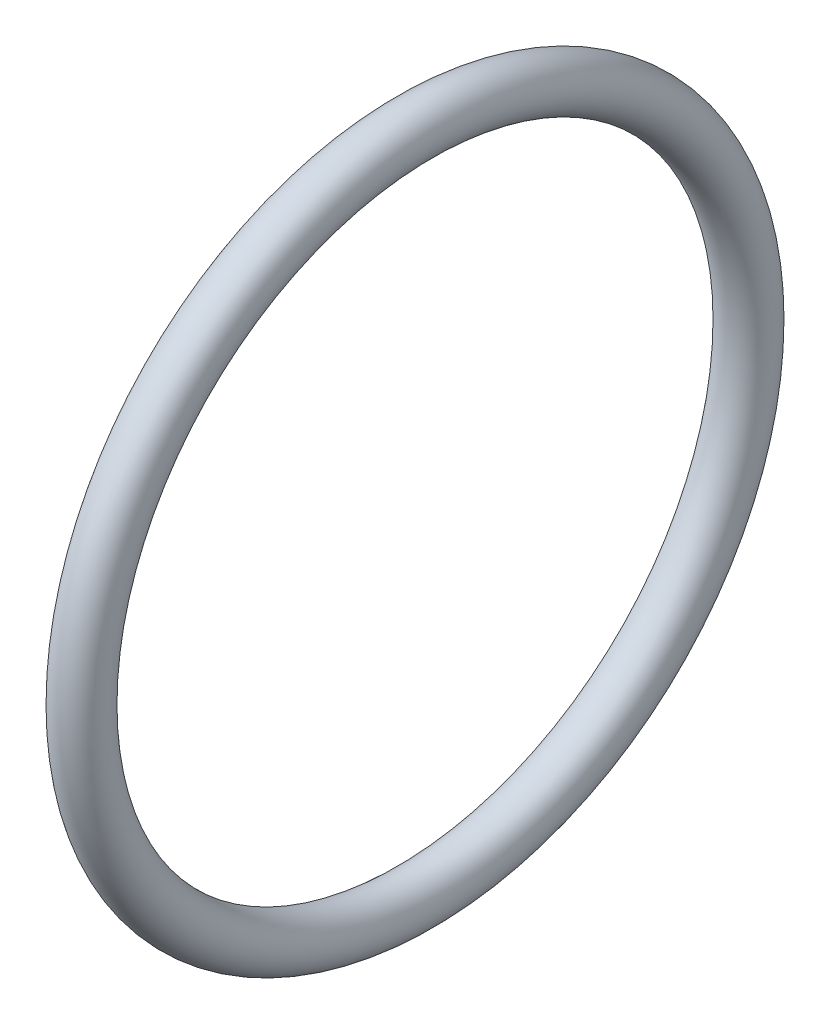
from build123d import *

# Parameters (mm, degrees)
SKETCH1_R = 1.75


with BuildPart() as part:
    # Sketch1 → Revolve1 (revolve)
    with BuildSketch(Plane.XY, mode=Mode.PRIVATE) as revolve1_sk:
        with Locations((0, 23.25)):
            Circle(SKETCH1_R)
    revolve(revolve1_sk.sketch.rotate(Axis((0, 0, 0), (1, 0, 0)), 90), axis=Axis((0, 0, 0), (1, 0, 0)))


solid = part.part
